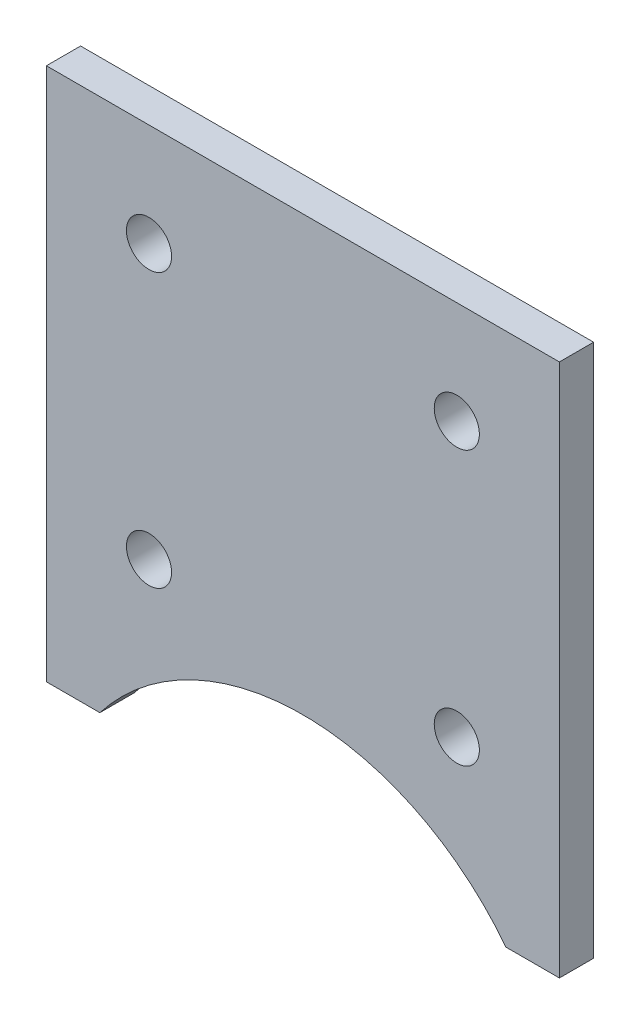
from build123d import *

# Parameters (mm, degrees)
BOSS_EXTRUDE1_DEPTH            = 5
M6_CLEARANCE_HOLE1_D           = 6.6
M6_CLEARANCE_HOLE1_CSINK_D     = 6.65
M6_CLEARANCE_HOLE1_CSINK_ANGLE = 90


with BuildPart() as part:
    # Sketch1 → Boss-Extrude1 (new body)
    with BuildSketch(Plane.XY):
        with BuildLine():
            Line((-37.5, 22.9169235), (-37.5, 60.9169235))
            Line((-37.5, 60.9169235), (-37.5, 100.9169235))
            Line((-37.5, 100.9169235), (37.5, 100.9169235))
            Line((37.5, 100.9169235), (37.5, 60.9169235))
            Line((37.5, 60.9169235), (37.5, 22.9169235))
            Line((37.5, 22.9169235), (29.682732645, 22.9169235))
            ThreePointArc((29.682732645, 22.9169235), (0, 37.5), (-29.682732645, 22.9169235))
            Line((-29.682732645, 22.9169235), (-37.5, 22.9169235))
        make_face()
    extrude(amount=BOSS_EXTRUDE1_DEPTH)

    # M6 Clearance Hole1 (through all)
    with Locations(Plane(origin=(0, 0, 0), x_dir=(-1, 0, 0), z_dir=(0, 0, -1))):
        with Locations((-22.5, 45.9169235), (22.5, 45.9169235), (22.5, 85.9169235), (-22.5, 85.9169235)):
            CounterSinkHole(M6_CLEARANCE_HOLE1_D / 2, M6_CLEARANCE_HOLE1_CSINK_D / 2, counter_sink_angle=M6_CLEARANCE_HOLE1_CSINK_ANGLE)


solid = part.part
